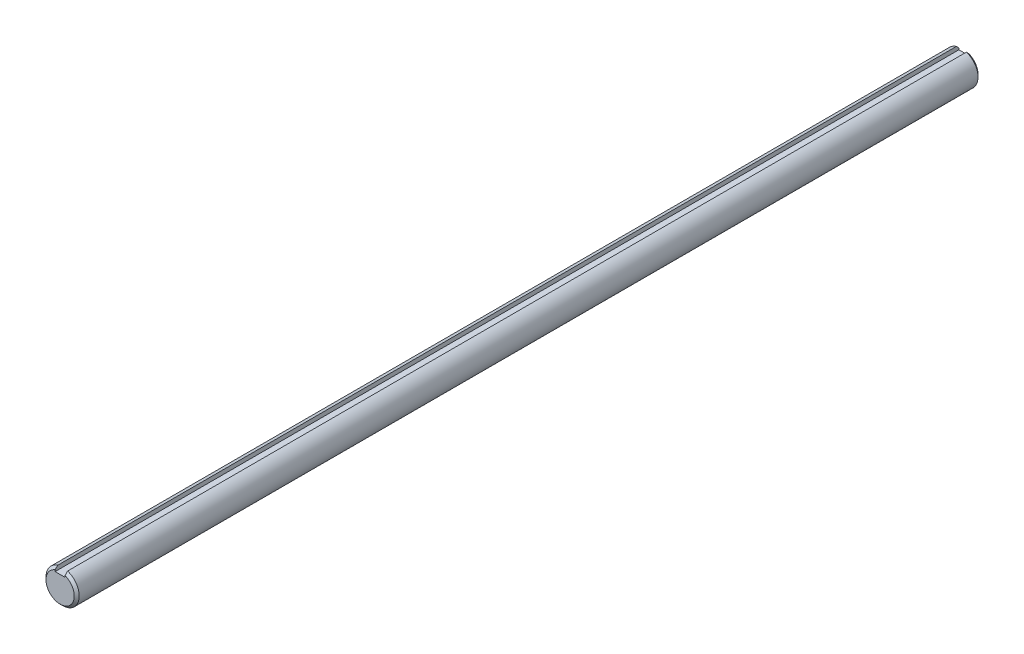
from build123d import *

# Parameters (mm, degrees)
SKETCH1_R           = 3.96875
EXTRUDE1_DEPTH      = 107.95
CHAMFER1_SIZE       = 0.5953125
EXTRUDE2_DEPTH      = 109.09581145
EXTRUDE2_DEPTH_BACK = 109.09581145
SKETCH3_W           = 2.38125
SKETCH3_H           = 1.190625


with BuildPart() as part:
    # Sketch1 → Extrude1 (new, symmetric)
    with BuildSketch(Plane.XY):
        Circle(SKETCH1_R)
    extrude(amount=EXTRUDE1_DEPTH, both=True)

    # Chamfer1
    chamfer1_edges = [part.edges().sort_by_distance(p)[0] for p in [
        (-3.96875, 0, -107.95),
        (-3.96875, 0, 107.95),
    ]]
    chamfer(chamfer1_edges, length=CHAMFER1_SIZE)

    # Sketch3 → Extrude2 (cut, two sides: drawn at the far end of the back side and taken through both)
    with BuildSketch(Plane.XY.offset(-EXTRUDE2_DEPTH_BACK)):
        with Locations((0, 3.3734375)):
            Rectangle(SKETCH3_W, SKETCH3_H)
    extrude(amount=EXTRUDE2_DEPTH + EXTRUDE2_DEPTH_BACK, mode=Mode.SUBTRACT)


solid = part.part
